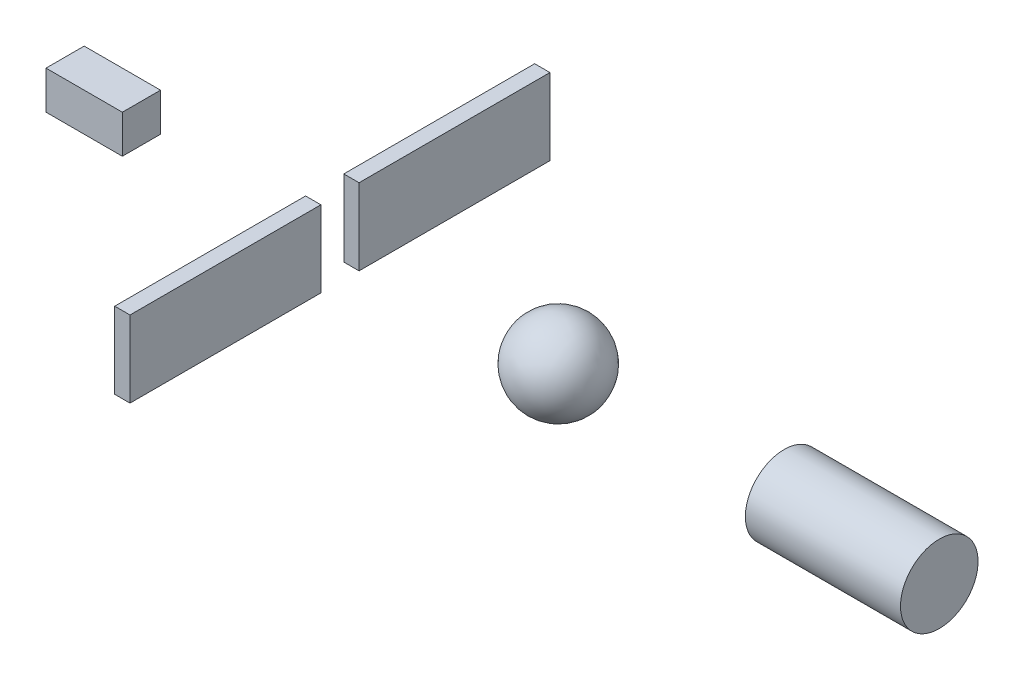
from build123d import *

# Parameters (mm, degrees)
SKETCH2_W             = 100
SKETCH2_H             = 50
BOSS_EXTRUDE2_DEPTH   = 25
SKETCH3_W             = 203.2
SKETCH3_H             = 50.8
SKETCH4_W             = 20
SKETCH4_H             = 250
BOSS_EXTRUDE3_DEPTH   = 50
BOSS_EXTRUDE3_2_DEPTH = 50


with BuildPart() as part:
    # Sketch2 → Boss-Extrude2 (new, symmetric)
    with BuildSketch(Plane.XY):
        with Locations((-300, 0)):
            Rectangle(SKETCH2_W, SKETCH2_H)
    extrude(amount=BOSS_EXTRUDE2_DEPTH, both=True)


with BuildPart() as body_2:
    # Sketch3 → Revolve1 (revolve)
    with BuildSketch(Plane(origin=(0, 0, 0), x_dir=(1, 0, 0), z_dir=(0, 1, 0))):
        with BuildLine():
            Line((240, 0), (351.7, 0))
            ThreePointArc((351.7, 0), (295.85, 55.85), (240, 0))
        make_face()
        with Locations((693.3, 25.4)):
            Rectangle(SKETCH3_W, SKETCH3_H)
    revolve(axis=Axis((0, 0, 0), (1, 0, 0)))


with BuildPart() as body_3:
    # Sketch4 → Boss-Extrude3 (new, symmetric)
    with BuildSketch(Plane(origin=(0, 0, 0), x_dir=(1, 0, 0), z_dir=(0, 1, 0))):
        with Locations((0, 150)):
            Rectangle(SKETCH4_W, SKETCH4_H)
    extrude(amount=BOSS_EXTRUDE3_DEPTH, both=True)


with BuildPart() as body_4:
    # Sketch4 → Boss-Extrude3 2 (new, symmetric)
    with BuildSketch(Plane(origin=(0, 0, 0), x_dir=(1, 0, 0), z_dir=(0, 1, 0))):
        with Locations((0, -150)):
            Rectangle(SKETCH4_W, SKETCH4_H)
    extrude(amount=BOSS_EXTRUDE3_2_DEPTH, both=True)


solid = Compound([part.part, body_2.part, body_3.part, body_4.part])
